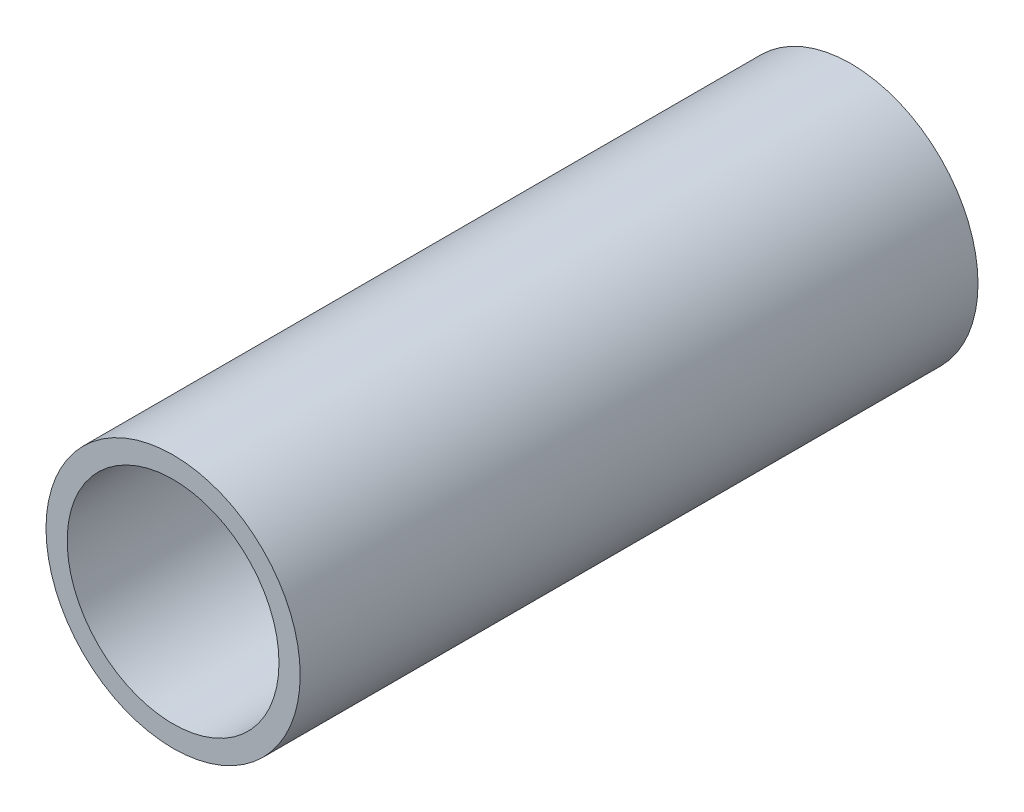
from build123d import *

# Parameters (mm, degrees)
SKETCH1_R           = 30
SKETCH1_R_2         = 25
BOSS_EXTRUDE1_DEPTH = 160


with BuildPart() as part:
    # Sketch1 → Boss-Extrude1 (new body)
    with BuildSketch(Plane.XY):
        Circle(SKETCH1_R)
        Circle(SKETCH1_R_2, mode=Mode.SUBTRACT)
    extrude(amount=BOSS_EXTRUDE1_DEPTH)


solid = part.part
